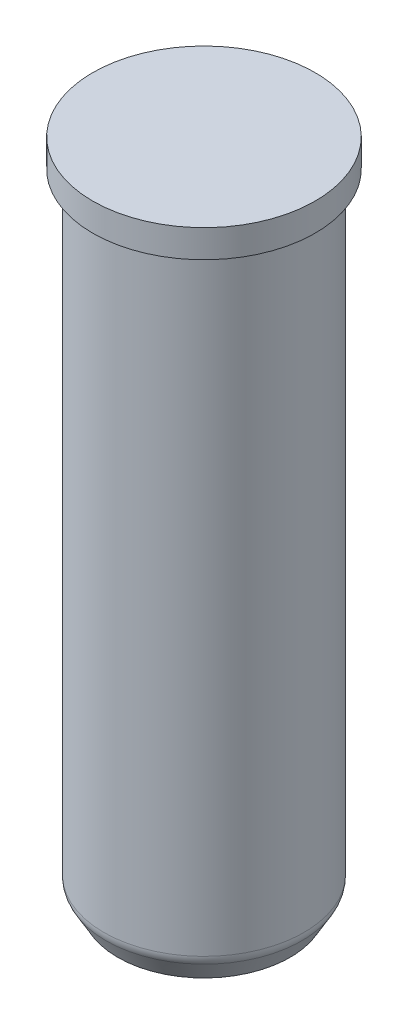
from build123d import *

# Parameters (mm, degrees)
SKETCH1_R           = 1.8
SKETCH1_R_2         = 1
BOSS_EXTRUDE1_DEPTH = 11.5
SKETCH2_R           = 2
BOSS_EXTRUDE2_DEPTH = 0.5
CHAMFER1_SIZE       = 0.25
CHAMFER1_SIZE2      = 0.433012702
FILLET1_R           = 0.3


with BuildPart() as part:
    # Sketch1 → Boss-Extrude1 (new body)
    with BuildSketch(Plane(origin=(0, 0, 0), x_dir=(1, 0, 0), z_dir=(0, 1, 0))):
        with Locations(Location((0, 0, 0), (0, 0, 270))):
            Circle(SKETCH1_R)
        with Locations(Location((0, 0, 0), (0, 0, 270))):
            Circle(SKETCH1_R_2, mode=Mode.SUBTRACT)
    extrude(amount=BOSS_EXTRUDE1_DEPTH)

    # Sketch2 → Boss-Extrude2 (add)
    with BuildSketch(Plane(origin=(0, 11.5, 0), x_dir=(1, 0, 0), z_dir=(0, 1, 0))):
        with Locations(Location((0, 0, 0), (0, 0, 270))):
            Circle(SKETCH2_R)
    extrude(amount=BOSS_EXTRUDE2_DEPTH)

    # Chamfer1
    chamfer1_edges = [part.edges().sort_by_distance(p)[0] for p in [
        (0, 0, -1.8),
    ]]
    chamfer1_side = [part.faces().sort_by_distance(p)[0] for p in [
        (0, 0, -1.749088312),
    ]]
    chamfer(chamfer1_edges, length=CHAMFER1_SIZE, length2=CHAMFER1_SIZE2, reference=chamfer1_side[0])

    # Fillet1
    fillet1_edges = [part.edges().sort_by_distance(p)[0] for p in [
        (0, 0.433012702, -1.8),
    ]]
    fillet(fillet1_edges, radius=FILLET1_R)


solid = part.part
